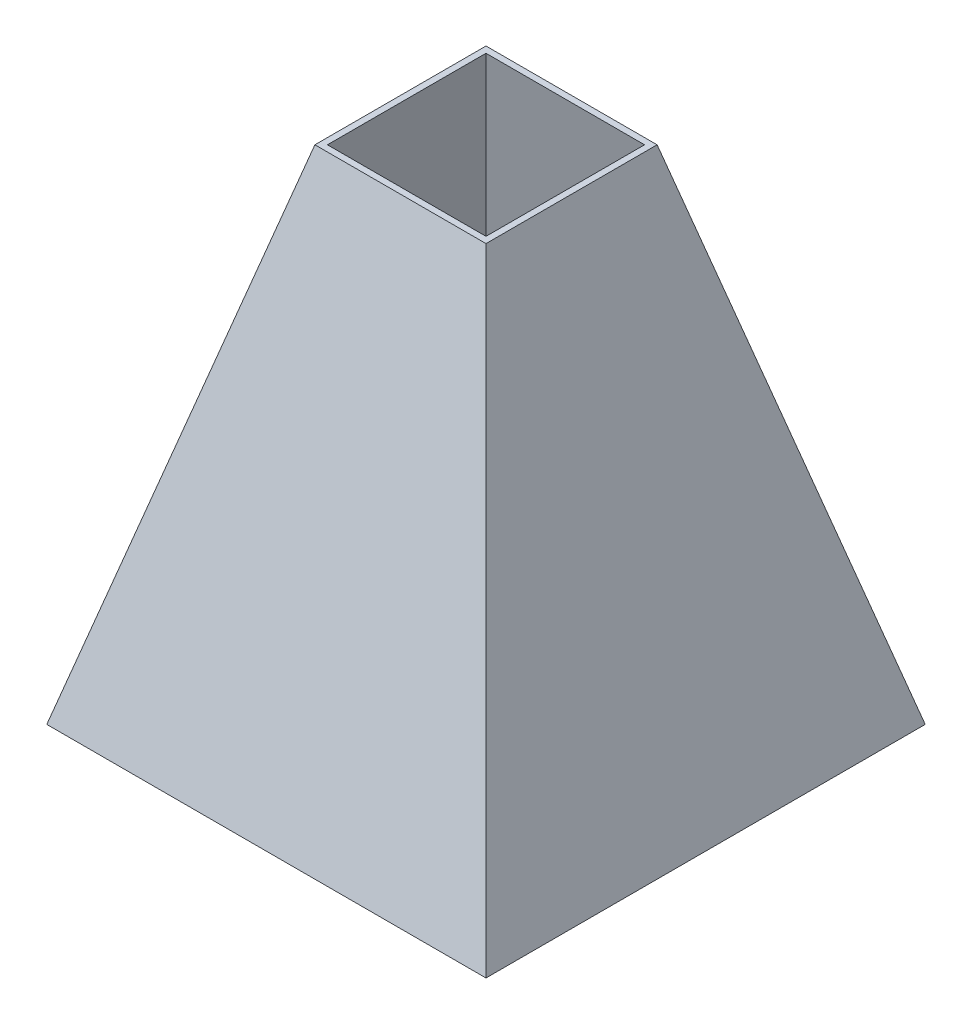
from build123d import *


with BuildPart() as part:
    # Sketch2 → Loft1 section 0
    with BuildSketch(Plane(origin=(0, 240, 0), x_dir=(1, 0, 0), z_dir=(0, 1, 0))):
        with BuildLine():
            Line((-40.905, 40.905), (40.905, 40.905))
            Line((40.905, 40.905), (40.905, -40.905))
            Line((40.905, -40.905), (-40.905, -40.905))
            Line((-40.905, -40.905), (-40.905, 40.905))
        make_face()
    # Sketch1 → Loft1 section 1
    with BuildSketch(Plane(origin=(0, 0, 0), x_dir=(1, 0, 0), z_dir=(0, 1, 0))):
        with BuildLine():
            Line((-105, 105), (105, 105))
            Line((105, 105), (105, -105))
            Line((105, -105), (-105, -105))
            Line((-105, -105), (-105, 105))
        make_face()
    loft()

    # Sketch5 → Cut-Loft1 section 0
    with BuildSketch(Plane.XZ):
        with BuildLine():
            Line((102, -102), (102, 102))
            Line((102, 102), (-102, 102))
            Line((-102, 102), (-102, -102))
            Line((-102, -102), (102, -102))
        make_face()
    # Sketch4 → Cut-Loft1 section 1
    with BuildSketch(Plane(origin=(0, 240, 0), x_dir=(1, 0, 0), z_dir=(0, 1, 0))):
        with BuildLine():
            Line((37.905, -37.905), (37.905, 37.905))
            Line((37.905, 37.905), (-37.905, 37.905))
            Line((-37.905, 37.905), (-37.905, -37.905))
            Line((-37.905, -37.905), (37.905, -37.905))
        make_face()
    loft(mode=Mode.SUBTRACT)


solid = part.part
